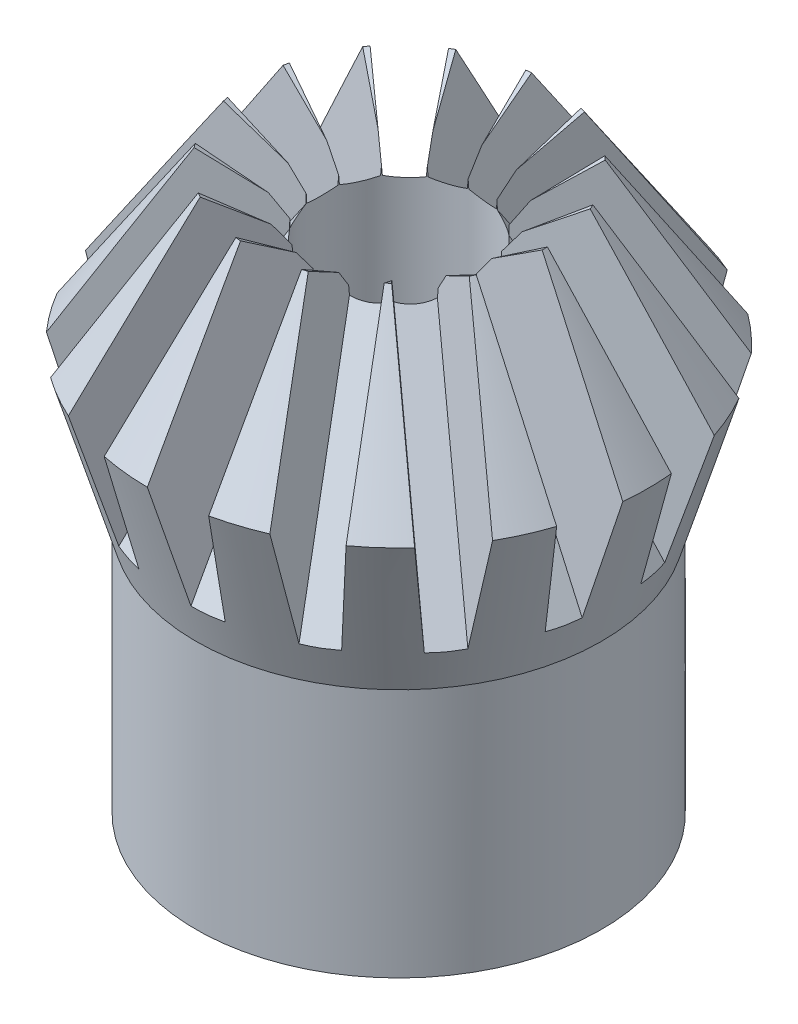
from build123d import *

# Parameters (mm, degrees)
CUT_EXTRUDE_START        = -8.494493
CUT_EXTRUDE_2_DEPTH      = 8.541722
PATTERN_CIRCULAR_1_COUNT = 15
CUT_EXTRUDE_3_REACH      = 23.26
CUT_EXTRUDE_3_END_RADIUS = 6.5
SKETCH_5_R               = 2


with BuildPart() as part:
    # 草图2 → 旋转1 (revolve)
    with BuildSketch(Plane(origin=(0, 0, 0), x_dir=(0, 0, -1), z_dir=(1, 0, 0))):
        Polygon((2.5, 0), (6.5, 0), (6.5, 8), (8, 13), (4.68337521, 18), (2.5, 16.551712731), align=None)
    revolve(axis=Axis((0, 0, 0), (0, 1, 0)))

    # 草图4 → 切除-拉伸2 (cut)
    with BuildSketch(Plane(origin=(6.860530662, 10.342639122, 0), x_dir=(0.8333333333333319, -0.5527707983925689, 0), z_dir=(0.5527707983925689, 0.8333333333333319, 0)).offset(CUT_EXTRUDE_START)):
        Polygon((-10.852687046, -0.5), (-10.852687046, 0.5), (-13.852687046, 0.9), (-13.852687046, -0.9), align=None)
    cut_extrude_2 = extrude(amount=CUT_EXTRUDE_2_DEPTH, mode=Mode.SUBTRACT)

    # 阵列(圆周)1: 切除-拉伸2 ×15 about axis
    pattern_circular_1_axis = Axis((0, 0, 0), (0, 1, 0))
    for i in range(1, PATTERN_CIRCULAR_1_COUNT):
        add(cut_extrude_2.rotate(pattern_circular_1_axis, i * 360 / PATTERN_CIRCULAR_1_COUNT), mode=Mode.SUBTRACT)

    # 切除-拉伸3: up to this cylinder (the profile starts inside it)
    cut_extrude_3_end = Plane(origin=(0, 4, 0), z_dir=(0, -1, 0)) * Cylinder(CUT_EXTRUDE_3_END_RADIUS, 60.52, mode=Mode.PRIVATE)
    # 草图5 → 切除-拉伸3 (cut, up to the surface)
    with BuildSketch(Plane.XY, mode=Mode.PRIVATE) as cut_extrude_3_sk1:
        with Locations((0, 4)):
            Circle(SKETCH_5_R)
    cut_extrude_3_tool1 = extrude(cut_extrude_3_sk1.sketch, amount=-CUT_EXTRUDE_3_REACH, mode=Mode.PRIVATE) & cut_extrude_3_end
    add(cut_extrude_3_tool1.solids().sort_by_distance((0, 4, 0))[0], mode=Mode.SUBTRACT)


solid = part.part
